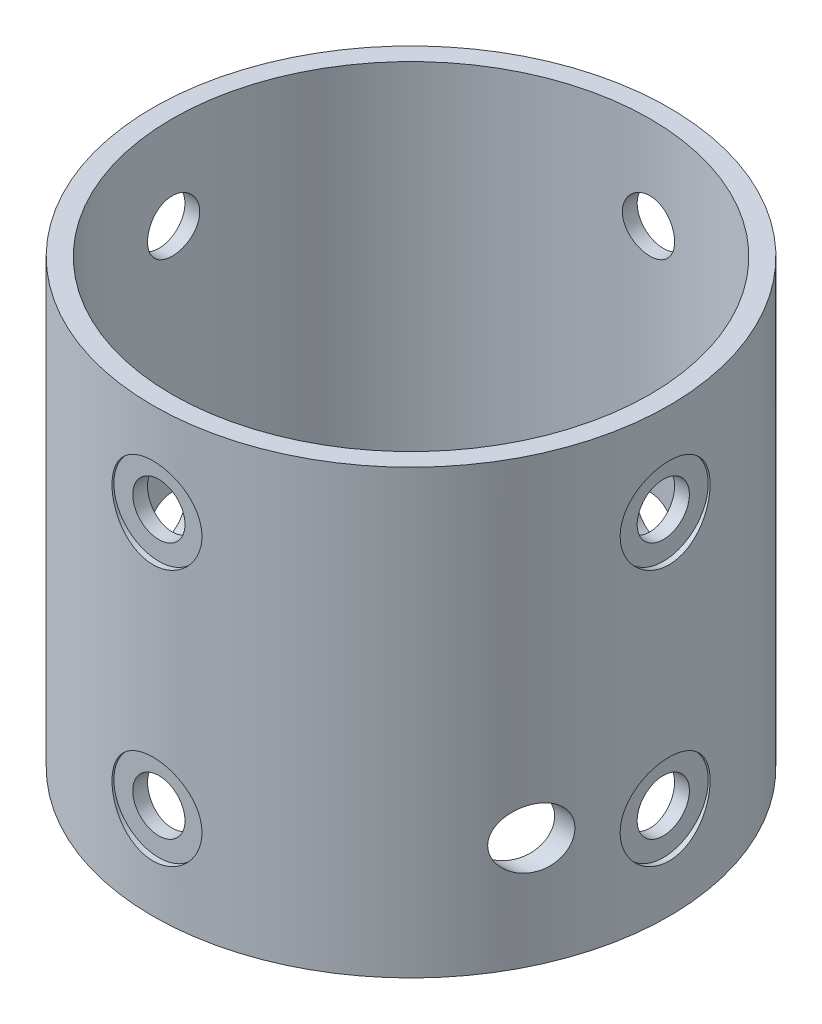
from build123d import *

# Parameters (mm, degrees)
SKETCH1_R                 = 22.225
SKETCH1_R_2               = 20.574
BOSS_EXTRUDE1_DEPTH       = 38.1
SKETCH2_R                 = 2.54
CUT_EXTRUDE1_DEPTH        = 50.8
SKETCH3_R                 = 3.875
SKETCH3_R_2               = 2.25
CUT_EXTRUDE2_DEPTH        = 0.5
SKETCH3_2_R               = 2.25
CUT_EXTRUDE3_DEPTH        = 16.17
CIRPATTERN1_COUNT         = 4
MIRROR1_COPY_1_SKETCH_R   = 3.875
MIRROR1_COPY_1_SKETCH_R_2 = 2.25
MIRROR1_COPY_1_DEPTH      = 0.5
MIRROR1_COPY_2_SKETCH_R   = 3.875
MIRROR1_COPY_2_SKETCH_R_2 = 2.25
MIRROR1_COPY_2_DEPTH      = 0.5
MIRROR1_COPY_3_SKETCH_R   = 3.875
MIRROR1_COPY_3_SKETCH_R_2 = 2.25
MIRROR1_COPY_3_DEPTH      = 0.5
MIRROR1_COPY_4_SKETCH_R   = 2.25
MIRROR1_COPY_4_DEPTH      = 16.17
MIRROR1_COPY_5_SKETCH_R   = 2.25
MIRROR1_COPY_5_DEPTH      = 16.17
MIRROR1_COPY_6_SKETCH_R   = 2.25
MIRROR1_COPY_6_DEPTH      = 16.17
MIRROR1_COPY_7_SKETCH_R   = 3.875
MIRROR1_COPY_7_SKETCH_R_2 = 2.25
MIRROR1_COPY_7_DEPTH      = 0.5
MIRROR1_COPY_8_SKETCH_R   = 2.25
MIRROR1_COPY_8_DEPTH      = 16.17


with BuildPart() as part:
    # Sketch1 → Boss-Extrude1 (new body)
    with BuildSketch(Plane(origin=(0, 0, 0), x_dir=(-1, 0, 0), z_dir=(0, 1, 0))):
        Circle(SKETCH1_R)
        Circle(SKETCH1_R_2, mode=Mode.SUBTRACT)
    extrude(amount=BOSS_EXTRUDE1_DEPTH)

    # Sketch2 → Cut-Extrude1 (cut)
    with BuildSketch(Plane.YZ):
        with Locations((9.525, 9.525)):
            Circle(SKETCH2_R)
    extrude(amount=CUT_EXTRUDE1_DEPTH, mode=Mode.SUBTRACT)

    # Sketch3 → Cut-Extrude2 (cut)
    with BuildSketch(Plane.XY.offset(22.225)):
        with Locations((0, 30.1)):
            Circle(SKETCH3_R)
        with Locations((0, 30.1)):
            Circle(SKETCH3_R_2, mode=Mode.SUBTRACT)
    cut_extrude2 = extrude(amount=-CUT_EXTRUDE2_DEPTH, mode=Mode.SUBTRACT)

    # Sketch3<2> → Cut-Extrude3 (cut)
    with BuildSketch(Plane.XY.offset(22.225)):
        with Locations((0, 30.1)):
            Circle(SKETCH3_2_R)
    cut_extrude3 = extrude(amount=-CUT_EXTRUDE3_DEPTH, mode=Mode.SUBTRACT)

    # CirPattern1: Cut-Extrude2, Cut-Extrude3 ×4 about axis
    cirpattern1_axis = Axis((0, 38.1, 0), (0, -1, 0))
    add([cut_extrude2.rotate(cirpattern1_axis, i * 360 / CIRPATTERN1_COUNT) for i in range(1, CIRPATTERN1_COUNT)], mode=Mode.SUBTRACT)
    add([cut_extrude3.rotate(cirpattern1_axis, i * 360 / CIRPATTERN1_COUNT) for i in range(1, CIRPATTERN1_COUNT)], mode=Mode.SUBTRACT)

    # Mirror1 copy 1 sketch → Mirror1 copy 1 (cut)
    with BuildSketch(Plane(origin=(-22.225, 38.1, 0), x_dir=(0, 0, 1), z_dir=(-1, 0, 0))):
        with Locations((0, -30.1)):
            Circle(MIRROR1_COPY_1_SKETCH_R)
        with Locations((0, -30.1)):
            Circle(MIRROR1_COPY_1_SKETCH_R_2, mode=Mode.SUBTRACT)
    extrude(amount=-MIRROR1_COPY_1_DEPTH, mode=Mode.SUBTRACT)

    # Mirror1 copy 2 sketch → Mirror1 copy 2 (cut)
    with BuildSketch(Plane(origin=(0, 38.1, -22.225), x_dir=(-1, 0, 0), z_dir=(0, 0, -1))):
        with Locations((0, -30.1)):
            Circle(MIRROR1_COPY_2_SKETCH_R)
        with Locations((0, -30.1)):
            Circle(MIRROR1_COPY_2_SKETCH_R_2, mode=Mode.SUBTRACT)
    extrude(amount=-MIRROR1_COPY_2_DEPTH, mode=Mode.SUBTRACT)

    # Mirror1 copy 3 sketch → Mirror1 copy 3 (cut)
    with BuildSketch(Plane(origin=(22.225, 38.1, 0), x_dir=(0, 0, -1), z_dir=(1, 0, 0))):
        with Locations((0, -30.1)):
            Circle(MIRROR1_COPY_3_SKETCH_R)
        with Locations((0, -30.1)):
            Circle(MIRROR1_COPY_3_SKETCH_R_2, mode=Mode.SUBTRACT)
    extrude(amount=-MIRROR1_COPY_3_DEPTH, mode=Mode.SUBTRACT)

    # Mirror1 copy 4 sketch → Mirror1 copy 4 (cut)
    with BuildSketch(Plane(origin=(-22.225, 38.1, 0), x_dir=(0, 0, 1), z_dir=(-1, 0, 0))):
        with Locations((0, -30.1)):
            Circle(MIRROR1_COPY_4_SKETCH_R)
    extrude(amount=-MIRROR1_COPY_4_DEPTH, mode=Mode.SUBTRACT)

    # Mirror1 copy 5 sketch → Mirror1 copy 5 (cut)
    with BuildSketch(Plane(origin=(0, 38.1, -22.225), x_dir=(-1, 0, 0), z_dir=(0, 0, -1))):
        with Locations((0, -30.1)):
            Circle(MIRROR1_COPY_5_SKETCH_R)
    extrude(amount=-MIRROR1_COPY_5_DEPTH, mode=Mode.SUBTRACT)

    # Mirror1 copy 6 sketch → Mirror1 copy 6 (cut)
    with BuildSketch(Plane(origin=(22.225, 38.1, 0), x_dir=(0, 0, -1), z_dir=(1, 0, 0))):
        with Locations((0, -30.1)):
            Circle(MIRROR1_COPY_6_SKETCH_R)
    extrude(amount=-MIRROR1_COPY_6_DEPTH, mode=Mode.SUBTRACT)

    # Mirror1 copy 7 sketch → Mirror1 copy 7 (cut)
    with BuildSketch(Plane(origin=(0, 38.1, 22.225), x_dir=(1, 0, 0), z_dir=(0, 0, 1))):
        with Locations((0, -30.1)):
            Circle(MIRROR1_COPY_7_SKETCH_R)
        with Locations((0, -30.1)):
            Circle(MIRROR1_COPY_7_SKETCH_R_2, mode=Mode.SUBTRACT)
    extrude(amount=-MIRROR1_COPY_7_DEPTH, mode=Mode.SUBTRACT)

    # Mirror1 copy 8 sketch → Mirror1 copy 8 (cut)
    with BuildSketch(Plane(origin=(0, 38.1, 22.225), x_dir=(1, 0, 0), z_dir=(0, 0, 1))):
        with Locations((0, -30.1)):
            Circle(MIRROR1_COPY_8_SKETCH_R)
    extrude(amount=-MIRROR1_COPY_8_DEPTH, mode=Mode.SUBTRACT)


solid = part.part
